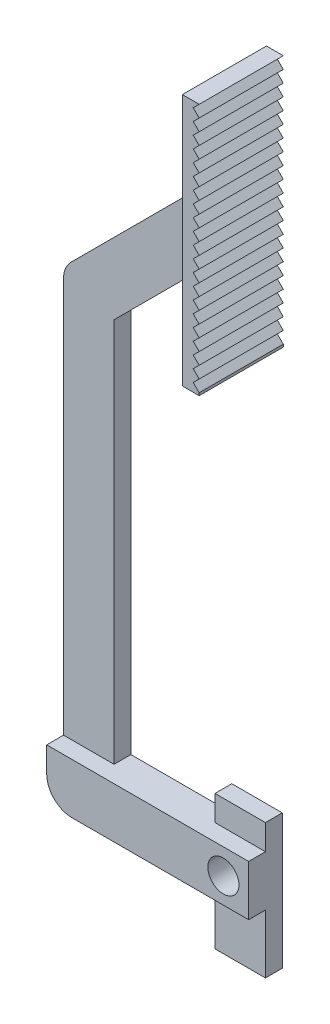
from build123d import *

# Parameters (mm, degrees)
SKETCH_1_R             = 1.85
EXTRUDE_1_DEPTH        = 2
SKETCH_4_W             = 6
SKETCH_4_H             = 3
SKETCH_4_H_2           = 7
CUT_EXTRUDE_2_DEPTH    = 2
EXTRUDE_2_DEPTH        = 2
SKETCH_5_W             = 10
SKETCH_5_H             = 30
EXTRUDE_3_DEPTH        = 2
CUT_EXTRUDE_3_DEPTH    = 10
PATTERN_LINEAR_1_COUNT = 21
PATTERN_LINEAR_1_PITCH = 1.414


with BuildPart() as part:
    # 草图1 → 凸台-拉伸1 (new, symmetric)
    with BuildSketch(Plane.XY):
        with BuildLine():
            Line((20, 6), (16, 6))
            Line((16, 6), (15, 6))
            Line((15, 6), (15, 3))
            Line((15, 3), (3, 3))
            Line((3, 3), (-3, 3))
            Line((-3, 3), (-3, 0))
            ThreePointArc((-3, 0), (-2.121320344, -2.121320344), (0, -3))
            Line((0, -3), (15, -3))
            Line((15, -3), (15, -10))
            Line((15, -10), (16, -10))
            Line((16, -10), (20, -10))
            Line((20, -10), (20.5, -10))
            Line((20.5, -10), (21, -10))
            Line((21, -10), (21, -3))
            Line((21, -3), (21, 3))
            Line((21, 3), (21, 6))
            Line((21, 6), (20, 6))
        make_face()
        with Locations((18, 0)):
            Circle(SKETCH_1_R, mode=Mode.SUBTRACT)
    extrude(amount=EXTRUDE_1_DEPTH, both=True)

    # 草图4 → 切除-拉伸2 (cut)
    with BuildSketch(Plane.XY.offset(2)):
        with Locations((18, 4.5)):
            Rectangle(SKETCH_4_W, SKETCH_4_H)
        with Locations((18, -6.5)):
            Rectangle(SKETCH_4_W, SKETCH_4_H_2)
    extrude(amount=-CUT_EXTRUDE_2_DEPTH, mode=Mode.SUBTRACT)

    # 草图1<3> → 凸台-拉伸2 (add)
    with BuildSketch(Plane.XY):
        with BuildLine():
            Line((-3, 3), (3, 3))
            Line((3, 3), (3, 48.757359313))
            Line((3, 48.757359313), (15.121320344, 60.878679656))
            Line((15.121320344, 60.878679656), (15.121320344, 69.363961031))
            Line((15.121320344, 69.363961031), (10.878679656, 65.121320344))
            Line((10.878679656, 65.121320344), (-2.121320344, 52.121320344))
            ThreePointArc((-2.121320344, 52.121320344), (-2.771638598, 51.148050297), (-3, 50))
            Line((-3, 50), (-3, 3))
        make_face()
    extrude(amount=-EXTRUDE_2_DEPTH)

    # 草图5 → 凸台-拉伸3 (add)
    with BuildSketch(Plane(origin=(15.121320344, 0, 0), x_dir=(0, 0, -1), z_dir=(1, 0, 0))):
        with Locations((1, 65)):
            Rectangle(SKETCH_5_W, SKETCH_5_H)
    extrude(amount=EXTRUDE_3_DEPTH)

    # 草图6 → 切除-拉伸3 (cut)
    with BuildSketch(Plane.XY.offset(4)):
        Polygon((17.121320344, 80), (16.414213562, 79.292893219), (17.121320344, 78.585786438), align=None)
    cut_extrude_3 = extrude(amount=-CUT_EXTRUDE_3_DEPTH, mode=Mode.SUBTRACT)

    # 阵列(线性)1: 切除-拉伸3 ×21
    with Locations(*[(0, -i * PATTERN_LINEAR_1_PITCH, 0) for i in range(1, PATTERN_LINEAR_1_COUNT)]):
        add(cut_extrude_3, mode=Mode.SUBTRACT)


solid = part.part
